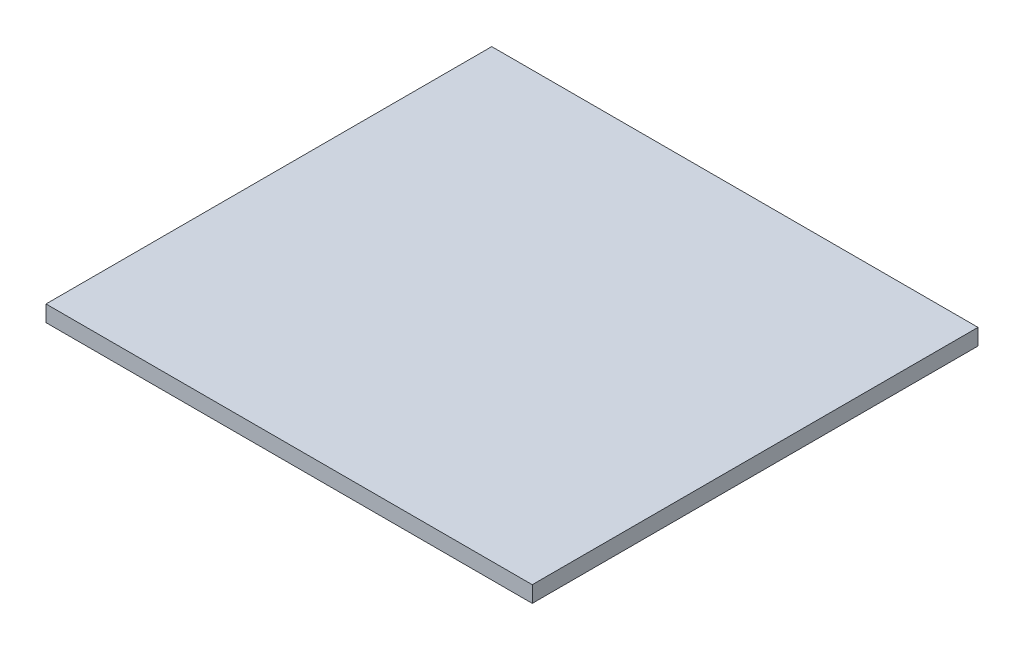
from build123d import *

# Parameters (mm, degrees)
SKETCH1_W           = 1200
SKETCH1_H           = 1100
BOSS_EXTRUDE1_DEPTH = 40


with BuildPart() as part:
    # Sketch1 → Boss-Extrude1 (new body)
    with BuildSketch(Plane(origin=(0, 0, 0), x_dir=(1, 0, 0), z_dir=(0, 1, 0))):
        Rectangle(SKETCH1_W, SKETCH1_H)
    extrude(amount=BOSS_EXTRUDE1_DEPTH)


solid = part.part
